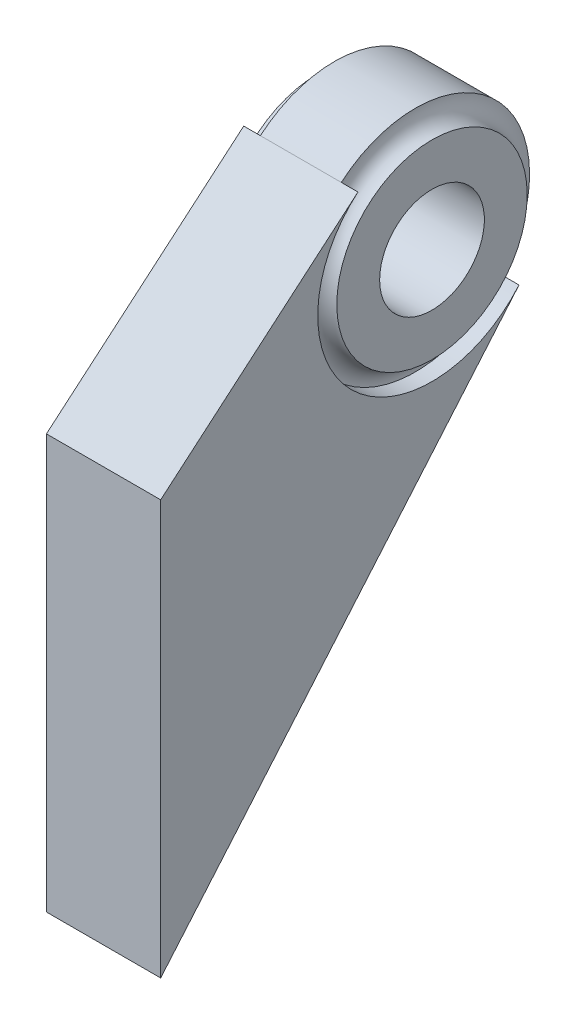
from build123d import *

# Parameters (mm, degrees)
BOSS_EXTRUDE1_DEPTH = 12


with BuildPart() as part:
    # Sketch2 → Revolve1 (revolve)
    with BuildSketch(Plane.XY.offset(-57), mode=Mode.PRIVATE) as revolve1_sk:
        with BuildLine():
            Line((-12, 115), (12, 115))
            Line((12, 115), (12, 124))
            ThreePointArc((12, 124), (9.421572875, 125.275126266), (8.5, 128))
            Line((8.5, 128), (-8.5, 128))
            ThreePointArc((-8.5, 128), (-9.421572875, 125.275126266), (-12, 124))
            Line((-12, 124), (-12, 115))
        make_face()
    revolve(revolve1_sk.sketch.rotate(Axis((-36.047482345, 104, -57), (1, 0, 0)), 90), axis=Axis((-36.047482345, 104, -57), (1, 0, 0)))

    # Sketch3 → Boss-Extrude1 (add, symmetric)
    with BuildSketch(Plane(origin=(0, 0, 0), x_dir=(0, 0, -1), z_dir=(1, 0, 0))):
        with BuildLine():
            Line((0, 0), (0, 87))
            Line((0, 87), (41.444008538, 122.275971373))
            ThreePointArc((41.444008538, 122.275971373), (40.02971958, 87.029154927), (75.276488949, 88.444616633))
            Line((75.276488949, 88.444616633), (0, 0))
        make_face()
    extrude(amount=BOSS_EXTRUDE1_DEPTH, both=True)


solid = part.part
